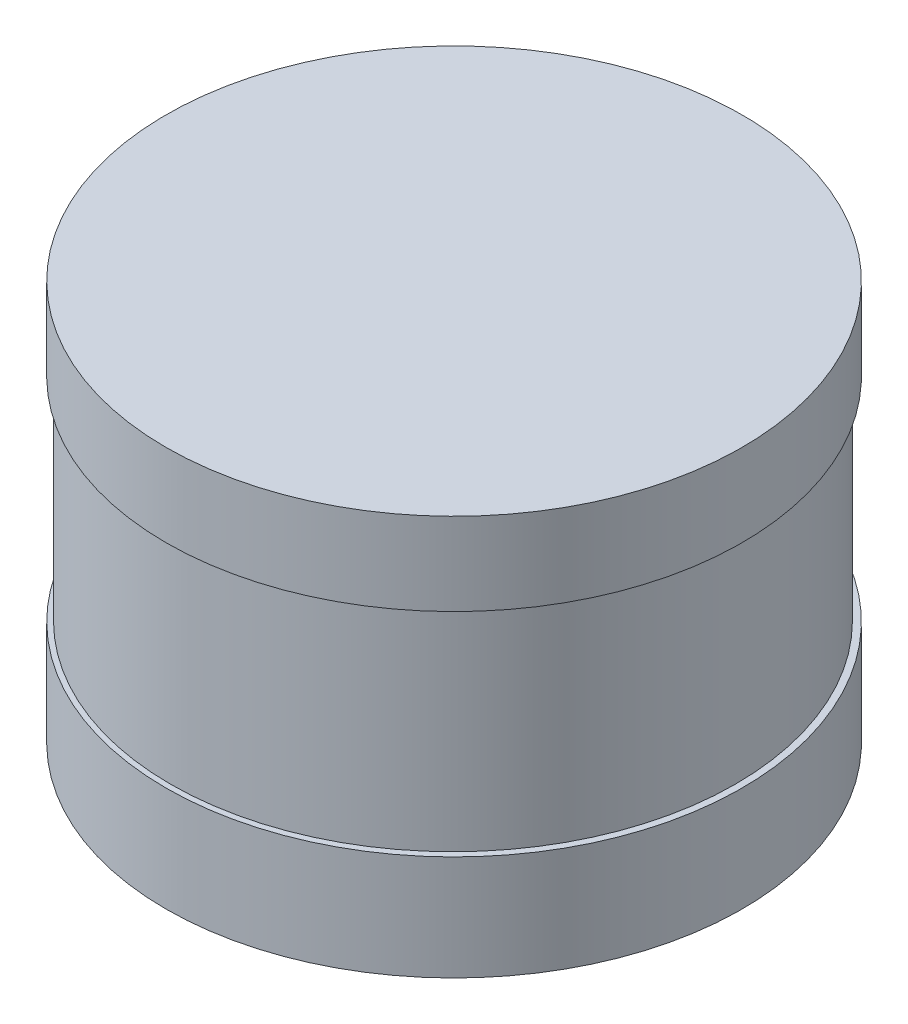
from build123d import *

# Parameters (mm, degrees)
SKETCH1_R           = 51.65
BOSS_EXTRUDE1_DEPTH = 18.8
SKETCH2_R           = 50.65
BOSS_EXTRUDE2_DEPTH = 38.1
SKETCH3_R           = 51.65
BOSS_EXTRUDE3_DEPTH = 14.8
SKETCH5_R           = 2.032
CUT_EXTRUDE1_DEPTH  = 5.5
SKETCH6_R           = 3.175
CUT_EXTRUDE2_DEPTH  = 7.1


with BuildPart() as part:
    # Sketch1 → Boss-Extrude1 (new body)
    with BuildSketch(Plane(origin=(0, 0, 0), x_dir=(1, 0, 0), z_dir=(0, 1, 0))):
        with Locations(Location((0, 0, 0), (0, 0, 270))):
            Circle(SKETCH1_R)
    extrude(amount=BOSS_EXTRUDE1_DEPTH)

    # Sketch5 → Cut-Extrude1 (cut)
    with BuildSketch(Plane.XZ):
        with Locations(Location((0, -44.45, 0), (0, 0, 270))):
            Circle(SKETCH5_R)
        with Locations(Location((0, 44.45, 0), (0, 0, 270))):
            Circle(SKETCH5_R)
    extrude(amount=-CUT_EXTRUDE1_DEPTH, mode=Mode.SUBTRACT)

    # Sketch6 → Cut-Extrude2 (cut)
    with BuildSketch(Plane.XZ):
        with Locations(Location((0, 0, 0), (0, 0, 270))):
            Circle(SKETCH6_R)
    extrude(amount=-CUT_EXTRUDE2_DEPTH, mode=Mode.SUBTRACT)


with BuildPart() as body_2:
    # Sketch2 → Boss-Extrude2 (new body)
    with BuildSketch(Plane(origin=(0, 18.8, 0), x_dir=(1, 0, 0), z_dir=(0, 1, 0))):
        with Locations(Location((-0.2, 0, 0), (0, 0, 90))):
            Circle(SKETCH2_R)
    extrude(amount=BOSS_EXTRUDE2_DEPTH)


with BuildPart() as body_3:
    # Sketch3 → Boss-Extrude3 (new body)
    with BuildSketch(Plane(origin=(0, 56.9, 0), x_dir=(1, 0, 0), z_dir=(0, 1, 0))):
        with Locations(Location((0, 0, 0), (0, 0, 270))):
            Circle(SKETCH3_R)
    extrude(amount=BOSS_EXTRUDE3_DEPTH)


solid = Compound([part.part, body_2.part, body_3.part])
